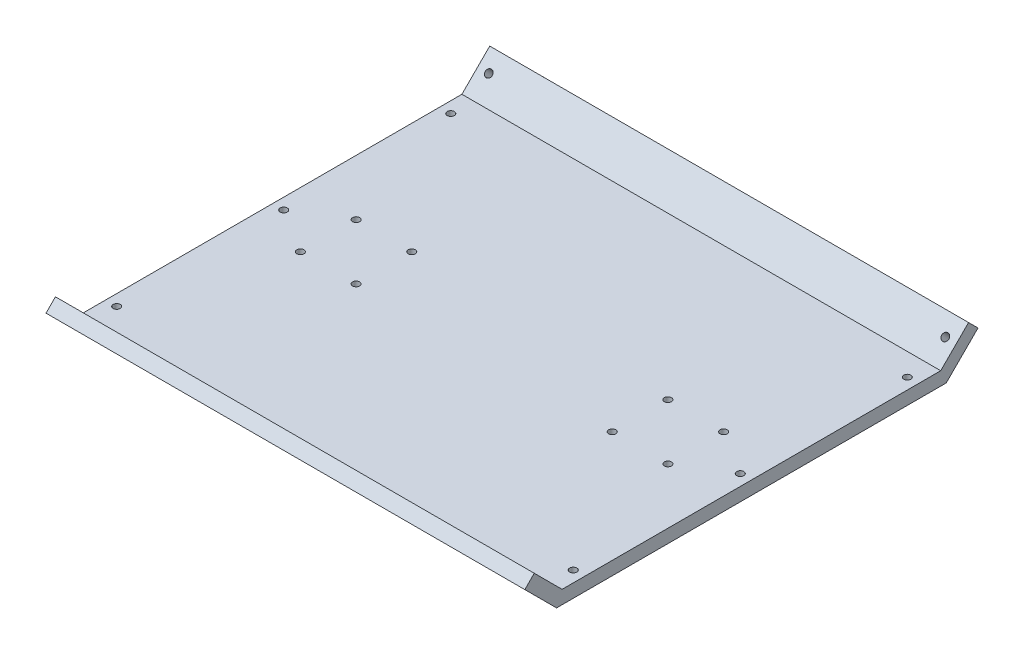
from build123d import *

# Parameters (mm, degrees)
MAIN_DEPTH                      = 107.5
F_3_0MM_DOWEL_HOLE1_D           = 3.2
F_3_0MM_DOWEL_HOLE1_ON_FACE_2_D = 3.2
F_3_0MM_DOWEL_HOLE1_ON_FACE_3_D = 3.2
F_3_0MM_DOWEL_HOLE1_ON_FACE_4_D = 3.2
SKETCH4_R                       = 1.6
ATTACHMENT_SCREW_HOLES_DEPTH    = 150.164556561


with BuildPart() as part:
    # Sketch2 → Main (new, symmetric)
    with BuildSketch(Plane(origin=(0, 0, 0), x_dir=(0, 0, -1), z_dir=(1, 0, 0))):
        Polygon((-85, 0), (85, 0), (97.5, 12.5), (101.742640687, 8.257359313), (87.485281374, -6), (-87.485281374, -6), (-101.742640687, 8.257359313), (-97.5, 12.5), align=None)
    extrude(amount=MAIN_DEPTH, both=True)

    # Ø3.0mm Dowel Hole1 (through all)
    with Locations(Plane(origin=(-102.5, 7.071067812, -92.071067812), x_dir=(0, 0.707106781187, -0.707106781187), z_dir=(0, 0.707106781187, 0.707106781187))):
        with Locations((0, 0)):
            Hole(F_3_0MM_DOWEL_HOLE1_D / 2)

    # Ø3.0mm Dowel Hole1 on face 2 (through all)
    with Locations(Plane(origin=(-102.5, 0, -75), x_dir=(0, 0, 1), z_dir=(0, 1, 0))):
        with Locations((0, 0), (75, 0), (150, 0), (150, 205), (75, 205), (0, 205)):
            Hole(F_3_0MM_DOWEL_HOLE1_ON_FACE_2_D / 2)

    # Ø3.0mm Dowel Hole1 on face 3 (through all)
    with Locations(Plane(origin=(-102.5, 7.071067812, 92.071067812), x_dir=(0, -0.707106781187, -0.707106781187), z_dir=(0, 0.707106781187, -0.707106781187))):
        with Locations((0, 0), (0, -205)):
            Hole(F_3_0MM_DOWEL_HOLE1_ON_FACE_3_D / 2)

    # Ø3.0mm Dowel Hole1 on face 4 (through all)
    with Locations(Plane(origin=(102.5, 7.071067812, -92.071067812), x_dir=(0, 0.707106781187, -0.707106781187), z_dir=(0, 0.707106781187, 0.707106781187))):
        with Locations((0, 0)):
            Hole(F_3_0MM_DOWEL_HOLE1_ON_FACE_4_D / 2)

    # Sketch4 → Attachment screw holes (cut, through all)
    with BuildSketch(Plane.XZ.offset(6)):
        with Locations(Location((57.5, 12.5, 0), (0, 0, 270))):
            Circle(SKETCH4_R)
        with Locations(Location((82.5, 12.5, 0), (0, 0, 270))):
            Circle(SKETCH4_R)
        with Locations(Location((82.5, -12.5, 0), (0, 0, 270))):
            Circle(SKETCH4_R)
        with Locations(Location((57.5, -12.5, 0), (0, 0, 270))):
            Circle(SKETCH4_R)
    attachment_screw_holes = extrude(amount=-ATTACHMENT_SCREW_HOLES_DEPTH, mode=Mode.SUBTRACT)

    # Mirror1: Attachment screw holes across plane
    add(attachment_screw_holes.mirror(Plane(origin=(0, 0, 0), x_dir=(0, 0, 1), z_dir=(1, 0, 0))), mode=Mode.SUBTRACT)


solid = part.part
